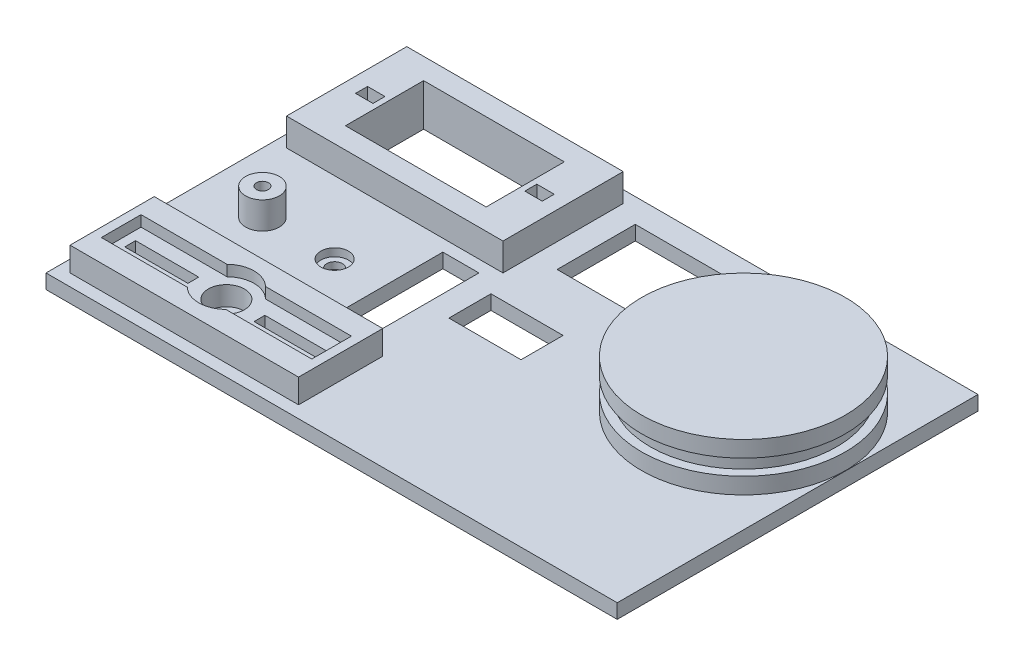
from build123d import *

# Parameters (mm, degrees)
SKETCH1_W            = 95
SKETCH1_H            = 2.4
BOSS_EXTRUDE1_DEPTH  = 60
BOSS_EXTRUDE2_START  = 2
SKETCH2_W            = 36
SKETCH2_H            = 4.6
BOSS_EXTRUDE2_DEPTH  = 20
BOSS_EXTRUDE3_START  = 5.5
SKETCH3_W            = 23.4
SKETCH3_H            = 9
BOSS_EXTRUDE3_DEPTH  = 13
BOSS_EXTRUDE4_START  = 11
SKETCH4_W            = 2.9
SKETCH4_H            = 9
BOSS_EXTRUDE4_DEPTH  = 2
BOSS_EXTRUDE5_START  = 11
SKETCH5_W            = 2.9
SKETCH5_H            = 9
BOSS_EXTRUDE5_DEPTH  = 2
BOSS_EXTRUDE6_START  = 4
SKETCH6_W            = 19.4
SKETCH6_H            = 4.4
BOSS_EXTRUDE6_DEPTH  = 13
BOSS_EXTRUDE7_START  = 2.4
SKETCH7_R            = 2.8
BOSS_EXTRUDE7_DEPTH  = 4.5
BOSS_EXTRUDE8_START  = 1.6
SKETCH8_R            = 1
BOSS_EXTRUDE8_DEPTH  = 6.3
BOSS_EXTRUDE9_START  = -1
SKETCH9_R            = 1.3
BOSS_EXTRUDE9_DEPTH  = 4.4
BOSS_EXTRUDE10_START = 1.1
SKETCH10_R           = 2.3
BOSS_EXTRUDE10_DEPTH = 2.3
BOSS_EXTRUDE11_START = 24
SKETCH11_W           = 6
SKETCH11_H           = 4.4
BOSS_EXTRUDE11_DEPTH = 17
BOSS_EXTRUDE12_START = 26
SKETCH12_W           = 12
SKETCH12_H           = 4.4
BOSS_EXTRUDE12_DEPTH = 7
BOSS_EXTRUDE13_START = 2.4
SKETCH13_R           = 16.95
BOSS_EXTRUDE13_DEPTH = 8
BOSS_EXTRUDE14_START = 5.1
SKETCH14_R           = 20
BOSS_EXTRUDE14_DEPTH = 2.6
BOSS_EXTRUDE15_START = 5.1
SKETCH15_R           = 15.5
BOSS_EXTRUDE15_DEPTH = 2.6
BOSS_EXTRUDE16_START = 44
SKETCH16_W           = 38
SKETCH16_H           = 4
BOSS_EXTRUDE16_DEPTH = 14
BOSS_EXTRUDE17_START = 4.6
SKETCH17_R           = 4.6
BOSS_EXTRUDE17_DEPTH = 2.3
BOSS_EXTRUDE18_START = 47.7
SKETCH18_W           = 17.5
SKETCH18_H           = 2.3
BOSS_EXTRUDE18_DEPTH = 6.6
BOSS_EXTRUDE19_START = 50.1
SKETCH19_W           = 10.5
SKETCH19_H           = 6
BOSS_EXTRUDE19_DEPTH = 1.8
BOSS_EXTRUDE20_START = 47.7
SKETCH20_W           = 17.5
SKETCH20_H           = 2.3
BOSS_EXTRUDE20_DEPTH = 6.6
BOSS_EXTRUDE21_START = 50.1
SKETCH21_W           = 10.5
SKETCH21_H           = 6
BOSS_EXTRUDE21_DEPTH = 1.8
BOSS_EXTRUDE22_START = 1.4
SKETCH22_R           = 3
BOSS_EXTRUDE22_DEPTH = 6


with BuildPart() as part:
    # Sketch1 → Boss-Extrude1 (new body)
    with BuildSketch(Plane.XY):
        with Locations((197.5, 1.2)):
            Rectangle(SKETCH1_W, SKETCH1_H)
    extrude(amount=BOSS_EXTRUDE1_DEPTH)

    # Sketch2 → Boss-Extrude2 (add)
    with BuildSketch(Plane.XY.offset(BOSS_EXTRUDE2_START)):
        with Locations((170, 4.7)):
            Rectangle(SKETCH2_W, SKETCH2_H)
    extrude(amount=BOSS_EXTRUDE2_DEPTH)


with BuildPart() as body_2:
    # Sketch3 → Boss-Extrude3 (new body)
    with BuildSketch(Plane.XY.offset(BOSS_EXTRUDE3_START)):
        with Locations((170, 3.5)):
            Rectangle(SKETCH3_W, SKETCH3_H)
    extrude(amount=BOSS_EXTRUDE3_DEPTH)


with BuildPart() as part_1:
    add(part.part)

    # Combine1: cut body 2
    add(body_2.part, mode=Mode.SUBTRACT)


with BuildPart() as body_2_2:
    # Sketch4 → Boss-Extrude4 (new body)
    with BuildSketch(Plane.XY.offset(BOSS_EXTRUDE4_START)):
        with Locations((155.925, 3.5)):
            Rectangle(SKETCH4_W, SKETCH4_H)
    extrude(amount=BOSS_EXTRUDE4_DEPTH)


with BuildPart() as part_2:
    add(part_1.part)

    # Combine2: cut body 2 2
    add(body_2_2.part, mode=Mode.SUBTRACT)


with BuildPart() as body_2_3:
    # Sketch5 → Boss-Extrude5 (new body)
    with BuildSketch(Plane.XY.offset(BOSS_EXTRUDE5_START)):
        with Locations((184.075, 3.5)):
            Rectangle(SKETCH5_W, SKETCH5_H)
    extrude(amount=BOSS_EXTRUDE5_DEPTH)


with BuildPart() as part_3:
    add(part_2.part)

    # Combine3: cut body 2 3
    add(body_2_3.part, mode=Mode.SUBTRACT)


with BuildPart() as body_2_4:
    # Sketch6 → Boss-Extrude6 (new body)
    with BuildSketch(Plane.XY.offset(BOSS_EXTRUDE6_START)):
        with Locations((201.7, 1.2)):
            Rectangle(SKETCH6_W, SKETCH6_H)
    extrude(amount=BOSS_EXTRUDE6_DEPTH)


with BuildPart() as part_4:
    add(part_3.part)

    # Combine4: cut body 2 4
    add(body_2_4.part, mode=Mode.SUBTRACT)

    # Sketch7 → Boss-Extrude7 (add)
    with BuildSketch(Plane(origin=(0, 0, 0), x_dir=(1, 0, 0), z_dir=(0, 1, 0)).offset(BOSS_EXTRUDE7_START)):
        with Locations((160, -34)):
            Circle(SKETCH7_R)
    extrude(amount=BOSS_EXTRUDE7_DEPTH)


with BuildPart() as body_2_5:
    # Sketch8 → Boss-Extrude8 (new body)
    with BuildSketch(Plane(origin=(0, 0, 0), x_dir=(1, 0, 0), z_dir=(0, 1, 0)).offset(BOSS_EXTRUDE8_START)):
        with Locations((160, -34)):
            Circle(SKETCH8_R)
    extrude(amount=BOSS_EXTRUDE8_DEPTH)


with BuildPart() as part_5:
    add(part_4.part)

    # Combine5: cut body 2 5
    add(body_2_5.part, mode=Mode.SUBTRACT)


with BuildPart() as body_2_6:
    # Sketch9 → Boss-Extrude9 (new body)
    with BuildSketch(Plane(origin=(0, 0, 0), x_dir=(1, 0, 0), z_dir=(0, 1, 0)).offset(BOSS_EXTRUDE9_START)):
        with Locations((172, -34)):
            Circle(SKETCH9_R)
    extrude(amount=BOSS_EXTRUDE9_DEPTH)


with BuildPart() as part_6:
    add(part_5.part)

    # Combine6: cut body 2 6
    add(body_2_6.part, mode=Mode.SUBTRACT)


with BuildPart() as body_2_7:
    # Sketch10 → Boss-Extrude10 (new body)
    with BuildSketch(Plane(origin=(0, 0, 0), x_dir=(1, 0, 0), z_dir=(0, 1, 0)).offset(BOSS_EXTRUDE10_START)):
        with Locations((172, -34)):
            Circle(SKETCH10_R)
    extrude(amount=BOSS_EXTRUDE10_DEPTH)


with BuildPart() as part_7:
    add(part_6.part)

    # Combine7: cut body 2 7
    add(body_2_7.part, mode=Mode.SUBTRACT)


with BuildPart() as body_2_8:
    # Sketch11 → Boss-Extrude11 (new body)
    with BuildSketch(Plane.XY.offset(BOSS_EXTRUDE11_START)):
        with Locations((183, 1.2)):
            Rectangle(SKETCH11_W, SKETCH11_H)
    extrude(amount=BOSS_EXTRUDE11_DEPTH)


with BuildPart() as part_8:
    add(part_7.part)

    # Combine8: cut body 2 8
    add(body_2_8.part, mode=Mode.SUBTRACT)


with BuildPart() as body_2_9:
    # Sketch12 → Boss-Extrude12 (new body)
    with BuildSketch(Plane.XY.offset(BOSS_EXTRUDE12_START)):
        with Locations((196, 1.2)):
            Rectangle(SKETCH12_W, SKETCH12_H)
    extrude(amount=BOSS_EXTRUDE12_DEPTH)


with BuildPart() as part_9:
    add(part_8.part)

    # Combine9: cut body 2 9
    add(body_2_9.part, mode=Mode.SUBTRACT)

    # Sketch13 → Boss-Extrude13 (add)
    with BuildSketch(Plane(origin=(0, 0, 0), x_dir=(1, 0, 0), z_dir=(0, 1, 0)).offset(BOSS_EXTRUDE13_START)):
        with Locations((228, -22)):
            Circle(SKETCH13_R)
    extrude(amount=BOSS_EXTRUDE13_DEPTH)


with BuildPart() as body_2_10:
    # Sketch14 → Boss-Extrude14 (new body)
    with BuildSketch(Plane(origin=(0, 0, 0), x_dir=(1, 0, 0), z_dir=(0, 1, 0)).offset(BOSS_EXTRUDE14_START)):
        with Locations((228, -22)):
            Circle(SKETCH14_R)
    extrude(amount=BOSS_EXTRUDE14_DEPTH)


with BuildPart() as part_10:
    add(part_9.part)

    # Combine10: cut body 2 10
    add(body_2_10.part, mode=Mode.SUBTRACT)

    # Sketch15 → Boss-Extrude15 (add)
    with BuildSketch(Plane(origin=(0, 0, 0), x_dir=(1, 0, 0), z_dir=(0, 1, 0)).offset(BOSS_EXTRUDE15_START)):
        with Locations((228, -22)):
            Circle(SKETCH15_R)
    extrude(amount=BOSS_EXTRUDE15_DEPTH)

    # Sketch16 → Boss-Extrude16 (add)
    with BuildSketch(Plane.XY.offset(BOSS_EXTRUDE16_START)):
        with Locations((171, 4.4)):
            Rectangle(SKETCH16_W, SKETCH16_H)
    extrude(amount=BOSS_EXTRUDE16_DEPTH)


with BuildPart() as body_2_11:
    # Sketch17 → Boss-Extrude17 (new body)
    with BuildSketch(Plane(origin=(0, 0, 0), x_dir=(1, 0, 0), z_dir=(0, 1, 0)).offset(BOSS_EXTRUDE17_START)):
        with Locations((171, -51)):
            Circle(SKETCH17_R)
    extrude(amount=BOSS_EXTRUDE17_DEPTH)


with BuildPart() as part_11:
    add(part_10.part)

    # Combine11: cut body 2 11
    add(body_2_11.part, mode=Mode.SUBTRACT)


with BuildPart() as body_2_12:
    # Sketch18 → Boss-Extrude18 (new body)
    with BuildSketch(Plane.XY.offset(BOSS_EXTRUDE18_START)):
        with Locations((179.75, 5.75)):
            Rectangle(SKETCH18_W, SKETCH18_H)
    extrude(amount=BOSS_EXTRUDE18_DEPTH)


with BuildPart() as part_12:
    add(part_11.part)

    # Combine12: cut body 2 12
    add(body_2_12.part, mode=Mode.SUBTRACT)


with BuildPart() as body_2_13:
    # Sketch19 → Boss-Extrude19 (new body)
    with BuildSketch(Plane.XY.offset(BOSS_EXTRUDE19_START)):
        with Locations((181.75, 4.4)):
            Rectangle(SKETCH19_W, SKETCH19_H)
    extrude(amount=BOSS_EXTRUDE19_DEPTH)


with BuildPart() as part_13:
    add(part_12.part)

    # Combine13: cut body 2 13
    add(body_2_13.part, mode=Mode.SUBTRACT)


with BuildPart() as body_2_14:
    # Sketch20 → Boss-Extrude20 (new body)
    with BuildSketch(Plane.XY.offset(BOSS_EXTRUDE20_START)):
        with Locations((162.25, 5.75)):
            Rectangle(SKETCH20_W, SKETCH20_H)
    extrude(amount=BOSS_EXTRUDE20_DEPTH)


with BuildPart() as part_14:
    add(part_13.part)

    # Combine14: cut body 2 14
    add(body_2_14.part, mode=Mode.SUBTRACT)


with BuildPart() as body_2_15:
    # Sketch21 → Boss-Extrude21 (new body)
    with BuildSketch(Plane.XY.offset(BOSS_EXTRUDE21_START)):
        with Locations((160.25, 4.4)):
            Rectangle(SKETCH21_W, SKETCH21_H)
    extrude(amount=BOSS_EXTRUDE21_DEPTH)


with BuildPart() as part_15:
    add(part_14.part)

    # Combine15: cut body 2 15
    add(body_2_15.part, mode=Mode.SUBTRACT)


with BuildPart() as body_2_16:
    # Sketch22 → Boss-Extrude22 (new body)
    with BuildSketch(Plane(origin=(0, 0, 0), x_dir=(1, 0, 0), z_dir=(0, 1, 0)).offset(BOSS_EXTRUDE22_START)):
        with Locations((171, -51)):
            Circle(SKETCH22_R)
    extrude(amount=BOSS_EXTRUDE22_DEPTH)


with BuildPart() as part_16:
    add(part_15.part)

    # Combine16: cut body 2 16
    add(body_2_16.part, mode=Mode.SUBTRACT)


solid = part_16.part
